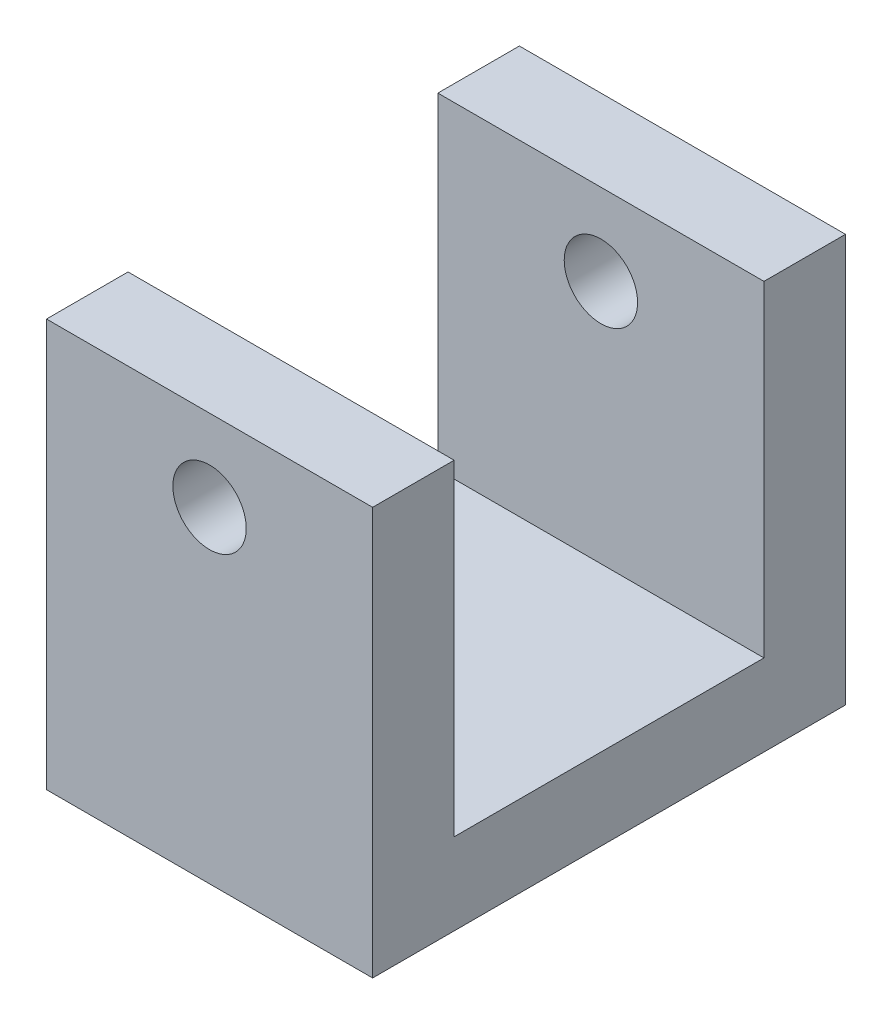
from build123d import *

# Parameters (mm, degrees)
SKETCH1_W           = 20
SKETCH1_H           = 29
BOSS_EXTRUDE1_DEPTH = 5
SKETCH2_W           = 20
SKETCH2_H           = 5
BOSS_EXTRUDE2_DEPTH = 20
SKETCH3_R           = 2.25
CUT_EXTRUDE1_DEPTH  = 40.572717875


with BuildPart() as part:
    # Sketch1 → Boss-Extrude1 (new body)
    with BuildSketch(Plane(origin=(0, 0, 0), x_dir=(1, 0, 0), z_dir=(0, 1, 0))):
        Rectangle(SKETCH1_W, SKETCH1_H)
    extrude(amount=BOSS_EXTRUDE1_DEPTH)

    # Sketch2 → Boss-Extrude2 (add)
    with BuildSketch(Plane(origin=(0, 5, 0), x_dir=(1, 0, 0), z_dir=(0, 1, 0))):
        with Locations((0, 12)):
            Rectangle(SKETCH2_W, SKETCH2_H)
        with Locations((0, -12)):
            Rectangle(SKETCH2_W, SKETCH2_H)
    extrude(amount=BOSS_EXTRUDE2_DEPTH)

    # Sketch3 → Cut-Extrude1 (cut, through all)
    with BuildSketch(Plane(origin=(0, 0, -14.5), x_dir=(-1, 0, 0), z_dir=(0, 0, -1))):
        with Locations((0, 20)):
            Circle(SKETCH3_R)
    extrude(amount=-CUT_EXTRUDE1_DEPTH, mode=Mode.SUBTRACT)


solid = part.part
